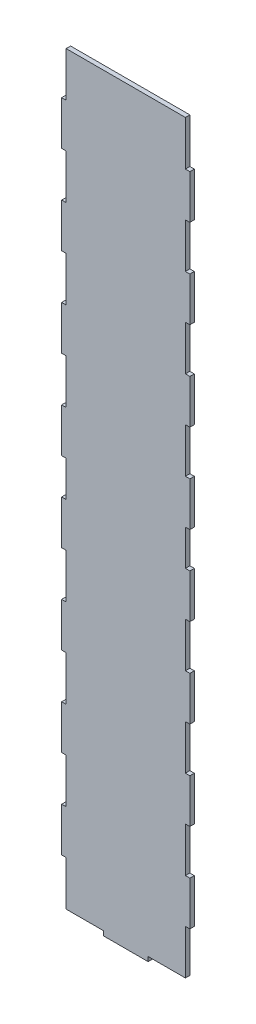
from build123d import *

# Parameters (mm, degrees)
RESSALTO_EXTRUS_O1_DEPTH = 3


with BuildPart() as part:
    # Esboço1 → Ressalto-extrusão1 (new body)
    with BuildSketch(Plane.XY):
        Polygon((-40, -250), (-15, -250), (-15, -253), (15, -253), (15, -250), (40, -250), (40, -220), (43, -220), (43, -190.5), (40, -190.5), (40, -160.5), (43, -160.5), (43, -131), (40, -131), (40, -101), (43, -101), (43, -71.5), (40, -71.5), (40, -41.5), (43, -41.5), (43, -12), (40, -12), (40, 12), (43, 12), (43, 41.5), (40, 41.5), (40, 71.5), (43, 71.5), (43, 101), (40, 101), (40, 131), (43, 131), (43, 160.5), (40, 160.5), (40, 190.5), (43, 190.5), (43, 220), (40, 220), (40, 250), (-40, 250), (-40, 220), (-43, 220), (-43, 190.5), (-40, 190.5), (-40, 160.5), (-43, 160.5), (-43, 131), (-40, 131), (-40, 101), (-43, 101), (-43, 71.5), (-40, 71.5), (-40, 41.5), (-43, 41.5), (-43, 12), (-40, 12), (-40, -12), (-43, -12), (-43, -41.5), (-40, -41.5), (-40, -71.5), (-43, -71.5), (-43, -101), (-40, -101), (-40, -131), (-43, -131), (-43, -160.5), (-40, -160.5), (-40, -190.5), (-43, -190.5), (-43, -220), (-40, -220), align=None)
    extrude(amount=RESSALTO_EXTRUS_O1_DEPTH)


solid = part.part
